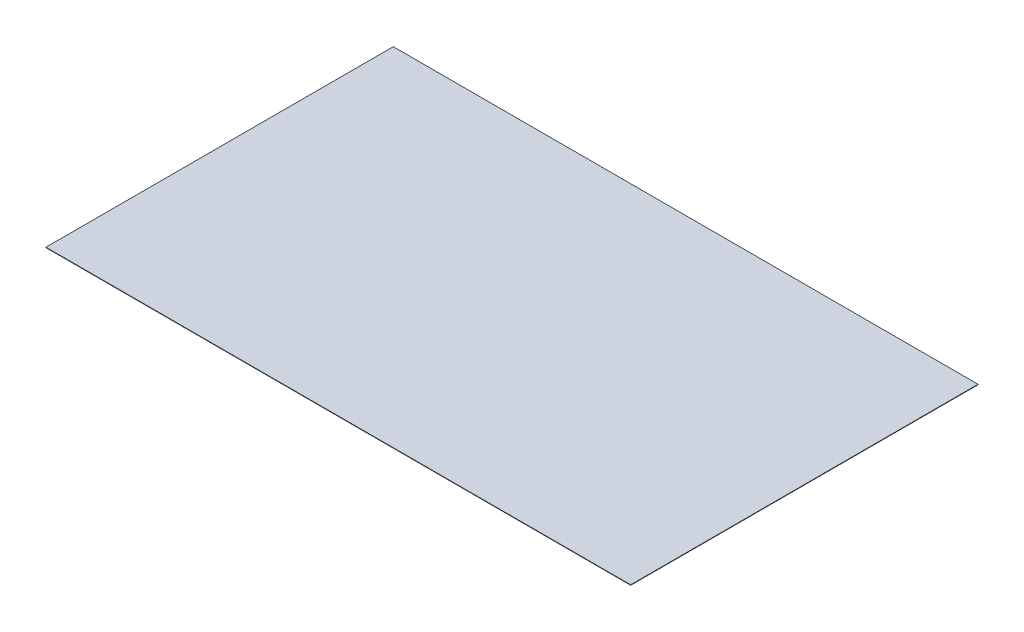
from build123d import *

# Parameters (mm, degrees)
SKETCH1_W                  = 1277
SKETCH1_H                  = 1
STORE_TEKNIK_TABAN_1_DEPTH = 758.5


with BuildPart() as part:
    # Sketch1 → STORE_teknik_taban_1 (new body)
    with BuildSketch(Plane.XY):
        with Locations((700, 1669.5)):
            Rectangle(SKETCH1_W, SKETCH1_H)
    extrude(amount=-STORE_TEKNIK_TABAN_1_DEPTH)


solid = part.part
